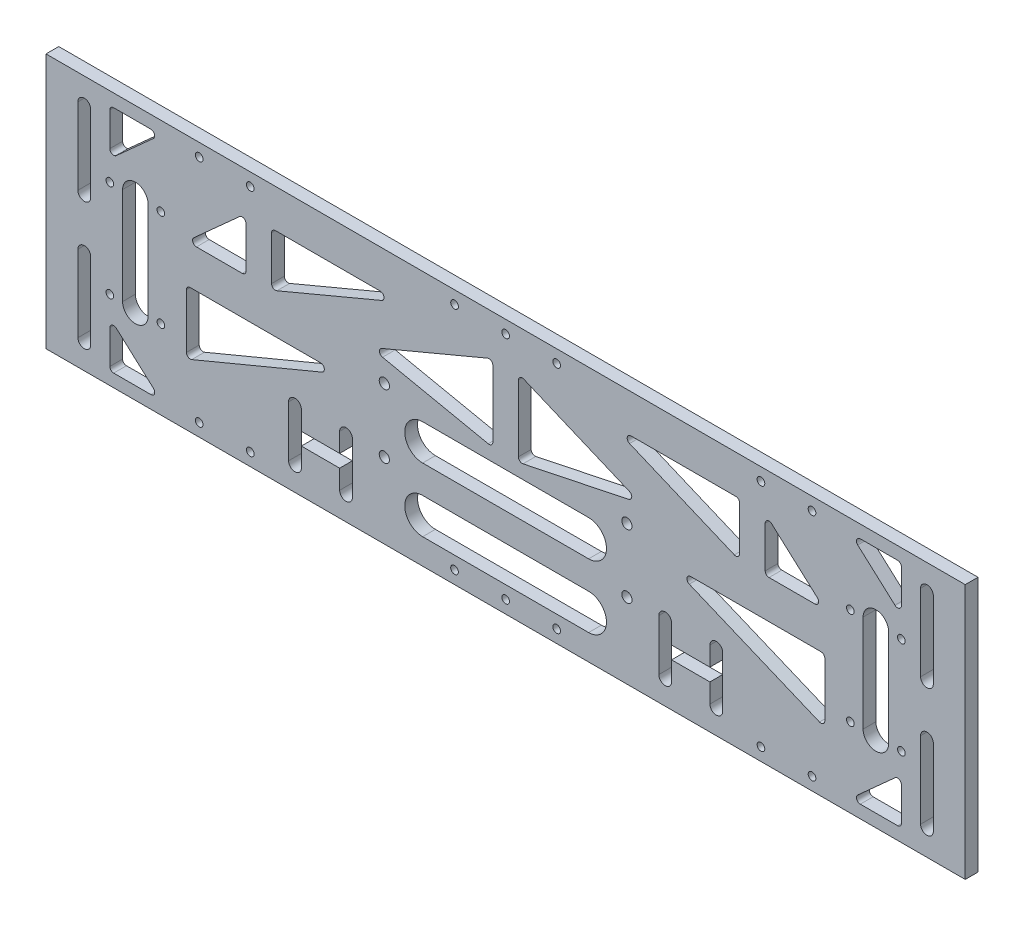
from build123d import *

# Parameters (mm, degrees)
SKETCH_1_W           = 320
SKETCH_1_H           = 121
EXTRUDE_1_DEPTH      = 5
SKETCH_2_W           = 5
SKETCH_2_H           = 30
CUT_EXTRUDE_1_DEPTH  = 343.14909031
SKETCH_3_R           = 1.5
CUT_EXTRUDE_2_DEPTH  = 343.14909031
SKETCH_4_R           = 1.5
CUT_EXTRUDE_3_DEPTH  = 343.14909031
SKETCH_6_R           = 2
CUT_EXTRUDE_5_DEPTH  = 343.14909031
SKETCH_5_W           = 250
SKETCH_5_H           = 30
CUT_EXTRUDE_4_DEPTH  = 343.14909031
SKETCH_7_W           = 260
SKETCH_7_H           = 30
EXTRUDE_2_DEPTH      = 5
SKETCH_8_W           = 320
SKETCH_8_H           = 21
CUT_EXTRUDE_6_DEPTH  = 5
SKETCH_9_W           = 15
SKETCH_9_H           = 100
EXTRUDE_3_DEPTH      = 5
CUT_EXTRUDE_7_DEPTH  = 5
CUT_EXTRUDE_8_DEPTH  = 5
SKETCH_15_R          = 1.5
CUT_EXTRUDE_9_DEPTH  = 357.217630108
SKETCH_16_W          = 5
SKETCH_16_H          = 19
CUT_EXTRUDE_10_DEPTH = 357.217630108
SKETCH_17_W          = 15
SKETCH_17_H          = 5
SKETCH_17_W_2        = 2.5
SKETCH_17_H_2        = 7.5
SKETCH_17_H_3        = 2.5
CUT_EXTRUDE_11_DEPTH = 357.217630108
SKETCH_18_W          = 5
SKETCH_18_H          = 100
EXTRUDE_4_DEPTH      = 5


with BuildPart() as part:
    # 草图1 → 凸台-拉伸1 (new body)
    with BuildSketch(Plane.XY):
        with Locations((160, 60.5)):
            Rectangle(SKETCH_1_W, SKETCH_1_H)
    extrude(amount=EXTRUDE_1_DEPTH)

    # 草图2 → 切除-拉伸1 (cut, through all)
    with BuildSketch(Plane.XY.offset(5)):
        with Locations((32.5, 15)):
            Rectangle(SKETCH_2_W, SKETCH_2_H)
        with Locations((287.5, 15)):
            Rectangle(SKETCH_2_W, SKETCH_2_H)
    extrude(amount=-CUT_EXTRUDE_1_DEPTH, mode=Mode.SUBTRACT)

    # 草图3 → 切除-拉伸2 (cut, through all)
    with BuildSketch(Plane.XY.offset(5)):
        with Locations((40, 116)):
            Circle(SKETCH_3_R)
        with Locations((60, 116)):
            Circle(SKETCH_3_R)
        with Locations((140, 116)):
            Circle(SKETCH_3_R)
        with Locations((160, 116)):
            Circle(SKETCH_3_R)
        with Locations(Location((260, 116, 0), (0, 0, 180))):
            Circle(SKETCH_3_R)
        with Locations(Location((280, 116, 0), (0, 0, 180))):
            Circle(SKETCH_3_R)
        with Locations(Location((180, 116, 0), (0, 0, 180))):
            Circle(SKETCH_3_R)
    extrude(amount=-CUT_EXTRUDE_2_DEPTH, mode=Mode.SUBTRACT)

    # 草图4 → 切除-拉伸3 (cut, through all)
    with BuildSketch(Plane.XY.offset(5)):
        with Locations((5, 90)):
            Circle(SKETCH_4_R)
        with Locations((25, 90)):
            Circle(SKETCH_4_R)
        with Locations((5, 10)):
            Circle(SKETCH_4_R)
        with Locations((25, 10)):
            Circle(SKETCH_4_R)
        with Locations(Location((295, 10, 0), (0, 0, 180))):
            Circle(SKETCH_4_R)
        with Locations(Location((315, 10, 0), (0, 0, 180))):
            Circle(SKETCH_4_R)
        with Locations(Location((295, 90, 0), (0, 0, 180))):
            Circle(SKETCH_4_R)
        with Locations(Location((315, 90, 0), (0, 0, 180))):
            Circle(SKETCH_4_R)
    extrude(amount=-CUT_EXTRUDE_3_DEPTH, mode=Mode.SUBTRACT)

    # 草图6 → 切除-拉伸5 (cut, through all)
    with BuildSketch(Plane.XY.offset(5)):
        with Locations((112.5, 75.5)):
            Circle(SKETCH_6_R)
        with Locations((207.5, 75.5)):
            Circle(SKETCH_6_R)
        with Locations((207.5, 50.5)):
            Circle(SKETCH_6_R)
        with Locations((112.5, 50.5)):
            Circle(SKETCH_6_R)
        with BuildLine():
            Line((127.5, 70), (192.5, 70))
            ThreePointArc((192.5, 70), (199.5, 63), (192.5, 56))
            Line((192.5, 56), (127.5, 56))
            ThreePointArc((127.5, 56), (120.5, 63), (127.5, 70))
        make_face()
    extrude(amount=-CUT_EXTRUDE_5_DEPTH, mode=Mode.SUBTRACT)

    # 草图5 → 切除-拉伸4 (cut, through all)
    with BuildSketch(Plane.XY.offset(5)):
        with BuildLine():
            Line((5, 101.368043607), (5, 114.5))
            ThreePointArc((5, 114.5), (5.439339828, 115.560660172), (6.5, 116))
            Line((6.5, 116), (21.091062659, 116))
            ThreePointArc((21.091062659, 116), (22.491493276, 115.037395651), (22.094509756, 113.385058781))
            Line((22.094509756, 113.385058781), (7.503447097, 100.253102388))
            ThreePointArc((7.503447097, 100.253102388), (5.889742123, 99.997793512), (5, 101.368043607))
        make_face()
        with BuildLine():
            Line((38.908937341, 85), (56.833333333, 85))
            ThreePointArc((56.833333333, 85), (57.893993505, 85.439339828), (58.333333333, 86.5))
            Line((58.333333333, 86.5), (58.333333333, 102.631956393))
            ThreePointArc((58.333333333, 102.631956393), (57.443591211, 104.002206488), (55.829886236, 103.746897612))
            Line((55.829886236, 103.746897612), (37.905490244, 87.614941219))
            ThreePointArc((37.905490244, 87.614941219), (37.508506724, 85.962604349), (38.908937341, 85))
        make_face()
        with BuildLine():
            Line((35, 68.5), (35, 47.25))
            ThreePointArc((35, 47.25), (35.667949706, 46.001924558), (37.076923077, 45.865384615))
            Line((37.076923077, 45.865384615), (88.076923077, 67.115384615))
            ThreePointArc((88.076923077, 67.115384615), (88.970871014, 68.794174203), (87.5, 70))
            Line((87.5, 70), (36.5, 70))
            ThreePointArc((36.5, 70), (35.439339828, 69.560660172), (35, 68.5))
        make_face()
        with Locations((160, 15)):
            Rectangle(SKETCH_5_W, SKETCH_5_H)
        with BuildLine():
            Line((68.333333333, 87.256929624), (68.333333333, 104.5))
            ThreePointArc((68.333333333, 104.5), (68.772673162, 105.560660172), (69.833333333, 106))
            Line((69.833333333, 106), (110.888262801, 106))
            ThreePointArc((110.888262801, 106), (112.358715068, 104.796260242), (111.469111528, 103.117026842))
            Line((111.469111528, 103.117026842), (70.41418206, 85.873956465))
            ThreePointArc((70.41418206, 85.873956465), (69.00305419, 86.007675228), (68.333333333, 87.256929624))
        make_face()
        with BuildLine():
            Line((111.788920254, 84.01540935), (153.193641955, 75.376872258))
            ThreePointArc((153.193641955, 75.376872258), (154.446166722, 75.68130869), (155, 76.845253935))
            Line((155, 76.845253935), (155, 102.873774141))
            ThreePointArc((155, 102.873774141), (154.330279143, 104.123028536), (152.919151273, 104.256747299))
            Line((152.919151273, 104.256747299), (111.514429572, 86.866764185))
            ThreePointArc((111.514429572, 86.866764185), (110.602180826, 85.340055375), (111.788920254, 84.01540935))
        make_face()
        with BuildLine():
            Line((167.080848727, 104.256747299), (208.485570428, 86.866764185))
            ThreePointArc((208.485570428, 86.866764185), (209.397819174, 85.340055375), (208.211079746, 84.01540935))
            Line((208.211079746, 84.01540935), (166.806358045, 75.376872258))
            ThreePointArc((166.806358045, 75.376872258), (165.553833278, 75.68130869), (165, 76.845253935))
            Line((165, 76.845253935), (165, 102.873774141))
            ThreePointArc((165, 102.873774141), (165.669720857, 104.123028536), (167.080848727, 104.256747299))
        make_face()
        with BuildLine():
            Line((208.530888472, 103.117026842), (249.58581794, 85.873956465))
            ThreePointArc((249.58581794, 85.873956465), (250.99694581, 86.007675228), (251.666666667, 87.256929624))
            Line((251.666666667, 87.256929624), (251.666666667, 104.5))
            ThreePointArc((251.666666667, 104.5), (251.227326838, 105.560660172), (250.166666667, 106))
            Line((250.166666667, 106), (209.111737199, 106))
            ThreePointArc((209.111737199, 106), (207.641284932, 104.796260242), (208.530888472, 103.117026842))
        make_face()
        with BuildLine():
            Line((232.5, 70), (283.5, 70))
            ThreePointArc((283.5, 70), (284.560660172, 69.560660172), (285, 68.5))
            Line((285, 68.5), (285, 47.25))
            ThreePointArc((285, 47.25), (284.332050294, 46.001924558), (282.923076923, 45.865384615))
            Line((282.923076923, 45.865384615), (231.923076923, 67.115384615))
            ThreePointArc((231.923076923, 67.115384615), (231.029128986, 68.794174203), (232.5, 70))
        make_face()
        with BuildLine():
            Line((264.170113764, 103.746897612), (282.094509756, 87.614941219))
            ThreePointArc((282.094509756, 87.614941219), (282.491493276, 85.962604349), (281.091062659, 85))
            Line((281.091062659, 85), (263.166666667, 85))
            ThreePointArc((263.166666667, 85), (262.106006495, 85.439339828), (261.666666667, 86.5))
            Line((261.666666667, 86.5), (261.666666667, 102.631956393))
            ThreePointArc((261.666666667, 102.631956393), (262.556408789, 104.002206488), (264.170113764, 103.746897612))
        make_face()
        with BuildLine():
            Line((297.905490244, 113.385058781), (312.496552903, 100.253102388))
            ThreePointArc((312.496552903, 100.253102388), (314.110257877, 99.997793512), (315, 101.368043607))
            Line((315, 101.368043607), (315, 114.5))
            ThreePointArc((315, 114.5), (314.560660172, 115.560660172), (313.5, 116))
            Line((313.5, 116), (298.908937341, 116))
            ThreePointArc((298.908937341, 116), (297.508506724, 115.037395651), (297.905490244, 113.385058781))
        make_face()
    extrude(amount=-CUT_EXTRUDE_4_DEPTH, mode=Mode.SUBTRACT)

    # 草图7 → 凸台-拉伸2 (add)
    with BuildSketch(Plane(origin=(0, 0, 0), x_dir=(-1, 0, 0), z_dir=(0, 0, -1))):
        with Locations((-160, 15)):
            Rectangle(SKETCH_7_W, SKETCH_7_H)
    extrude(amount=-EXTRUDE_2_DEPTH)

    # 草图8 → 切除-拉伸6 (cut)
    with BuildSketch(Plane(origin=(0, 0, 0), x_dir=(-1, 0, 0), z_dir=(0, 0, -1))):
        with Locations((-160, 10.5)):
            Rectangle(SKETCH_8_W, SKETCH_8_H)
    extrude(amount=-CUT_EXTRUDE_6_DEPTH, mode=Mode.SUBTRACT)

    # 草图9 → 凸台-拉伸3 (add)
    with BuildSketch(Plane(origin=(0, 0, 0), x_dir=(-1, 0, 0), z_dir=(0, 0, -1))):
        with Locations((-327.5, 71)):
            Rectangle(SKETCH_9_W, SKETCH_9_H)
        with Locations((7.5, 71)):
            Rectangle(SKETCH_9_W, SKETCH_9_H)
    extrude(amount=-EXTRUDE_3_DEPTH)

    # 草图10 → 切除-拉伸7 (cut)
    with BuildSketch(Plane(origin=(0, 0, 0), x_dir=(-1, 0, 0), z_dir=(0, 0, -1))):
        with BuildLine():
            Line((-325, 111), (-325, 81))
            Line((-325, 81), (-325, 78.5))
            ThreePointArc((-325, 78.5), (-323.232233047, 79.232233047), (-322.5, 81))
            Line((-322.5, 81), (-322.5, 111))
            ThreePointArc((-322.5, 111), (-323.232233047, 112.767766953), (-325, 113.5))
            Line((-325, 113.5), (-325, 111))
        make_face()
        with BuildLine():
            Line((-325, 78.5), (-325, 81))
            Line((-325, 81), (-325, 111))
            Line((-325, 111), (-325, 113.5))
            ThreePointArc((-325, 113.5), (-326.767766953, 112.767766953), (-327.5, 111))
            Line((-327.5, 111), (-327.5, 81))
            ThreePointArc((-327.5, 81), (-326.767766953, 79.232233047), (-325, 78.5))
        make_face()
        with BuildLine():
            ThreePointArc((-322.5, 61), (-323.232233047, 62.767766953), (-325, 63.5))
            Line((-325, 63.5), (-325, 61))
            Line((-325, 61), (-325, 31))
            Line((-325, 31), (-325, 28.5))
            ThreePointArc((-325, 28.5), (-323.232233047, 29.232233047), (-322.5, 31))
            Line((-322.5, 31), (-322.5, 61))
        make_face()
        with BuildLine():
            Line((-325, 61), (-325, 63.5))
            ThreePointArc((-325, 63.5), (-326.767766953, 62.767766953), (-327.5, 61))
            Line((-327.5, 61), (-327.5, 31))
            ThreePointArc((-327.5, 31), (-326.767766953, 29.232233047), (-325, 28.5))
            Line((-325, 28.5), (-325, 31))
            Line((-325, 31), (-325, 61))
        make_face()
        with BuildLine():
            Line((5, 113.5), (5, 78.5))
            ThreePointArc((5, 78.5), (6.767766953, 79.232233047), (7.5, 81))
            Line((7.5, 81), (7.5, 111))
            ThreePointArc((7.5, 111), (6.767766953, 112.767766953), (5, 113.5))
        make_face()
        with BuildLine():
            ThreePointArc((2.5, 81), (3.232233047, 79.232233047), (5, 78.5))
            Line((5, 78.5), (5, 113.5))
            ThreePointArc((5, 113.5), (3.232233047, 112.767766953), (2.5, 111))
            Line((2.5, 111), (2.5, 81))
        make_face()
        with BuildLine():
            ThreePointArc((7.5, 61), (6.767766953, 62.767766953), (5, 63.5))
            Line((5, 63.5), (5, 28.5))
            ThreePointArc((5, 28.5), (6.767766953, 29.232233047), (7.5, 31))
            Line((7.5, 31), (7.5, 61))
        make_face()
        with BuildLine():
            Line((5, 28.5), (5, 63.5))
            ThreePointArc((5, 63.5), (3.232233047, 62.767766953), (2.5, 61))
            Line((2.5, 61), (2.5, 31))
            ThreePointArc((2.5, 31), (3.232233047, 29.232233047), (5, 28.5))
        make_face()
    extrude(amount=-CUT_EXTRUDE_7_DEPTH, mode=Mode.SUBTRACT)

    # 草图13 → 切除-拉伸8 (cut)
    with BuildSketch(Plane(origin=(0, 0, 0), x_dir=(-1, 0, 0), z_dir=(0, 0, -1))):
        with BuildLine():
            Line((-192.5, 45), (-127.5, 45))
            ThreePointArc((-127.5, 45), (-120.5, 38), (-127.5, 31))
            Line((-127.5, 31), (-192.5, 31))
            ThreePointArc((-192.5, 31), (-199.5, 38), (-192.5, 45))
        make_face()
    extrude(amount=-CUT_EXTRUDE_8_DEPTH, mode=Mode.SUBTRACT)

    # 草图15 → 切除-拉伸9 (cut, through all)
    with BuildSketch(Plane(origin=(0, 0, 0), x_dir=(-1, 0, 0), z_dir=(0, 0, -1))):
        with Locations((-315, 52)):
            Circle(SKETCH_15_R)
        with BuildLine():
            ThreePointArc((-315, 40.631956393), (-314.110257877, 42.002206488), (-312.496552903, 41.746897612))
            Line((-312.496552903, 41.746897612), (-297.905490244, 28.614941219))
            ThreePointArc((-297.905490244, 28.614941219), (-297.508506724, 26.962604349), (-298.908937341, 26))
            Line((-298.908937341, 26), (-313.5, 26))
            ThreePointArc((-313.5, 26), (-314.560660172, 26.439339828), (-315, 27.5))
            Line((-315, 27.5), (-315, 40.631956393))
        make_face()
        with Locations((-295, 52)):
            Circle(SKETCH_15_R)
        with Locations((-280, 26)):
            Circle(SKETCH_15_R)
        with Locations((-260, 26)):
            Circle(SKETCH_15_R)
        with Locations((-180, 26)):
            Circle(SKETCH_15_R)
        with Locations((-160, 26)):
            Circle(SKETCH_15_R)
        with Locations((-140, 26)):
            Circle(SKETCH_15_R)
        with Locations((-60, 26)):
            Circle(SKETCH_15_R)
        with Locations((-40, 26)):
            Circle(SKETCH_15_R)
        with BuildLine():
            ThreePointArc((-21.091062659, 26), (-22.491493276, 26.962604349), (-22.094509756, 28.614941219))
            Line((-22.094509756, 28.614941219), (-7.503447097, 41.746897612))
            ThreePointArc((-7.503447097, 41.746897612), (-5.889742123, 42.002206488), (-5, 40.631956393))
            Line((-5, 40.631956393), (-5, 27.5))
            ThreePointArc((-5, 27.5), (-5.439339828, 26.439339828), (-6.5, 26))
            Line((-6.5, 26), (-21.091062659, 26))
        make_face()
        with Locations((-5, 52)):
            Circle(SKETCH_15_R)
        with Locations((-25, 52)):
            Circle(SKETCH_15_R)
    extrude(amount=-CUT_EXTRUDE_9_DEPTH, mode=Mode.SUBTRACT)

    # 草图16 → 切除-拉伸10 (cut, through all)
    with BuildSketch(Plane(origin=(0, 0, 0), x_dir=(-1, 0, 0), z_dir=(0, 0, -1))):
        with Locations((-302.5, 61.5)):
            Rectangle(SKETCH_16_W, SKETCH_16_H)
        with BuildLine():
            Line((-305, 52), (-310, 52))
            ThreePointArc((-310, 52), (-305, 47), (-300, 52))
            Line((-300, 52), (-305, 52))
        make_face()
        with Locations((-307.5, 61.5)):
            Rectangle(SKETCH_16_W, SKETCH_16_H)
        with Locations((-302.5, 80.5)):
            Rectangle(SKETCH_16_W, SKETCH_16_H)
        with Locations((-307.5, 80.5)):
            Rectangle(SKETCH_16_W, SKETCH_16_H)
        with BuildLine():
            ThreePointArc((-300, 90), (-305, 95), (-310, 90))
            Line((-310, 90), (-305, 90))
            Line((-305, 90), (-300, 90))
        make_face()
        with BuildLine():
            Line((-10, 71), (-20, 71))
            Line((-20, 71), (-20, 52))
            ThreePointArc((-20, 52), (-15, 47), (-10, 52))
            Line((-10, 52), (-10, 71))
        make_face()
        with BuildLine():
            Line((-20, 90), (-20, 71))
            Line((-20, 71), (-10, 71))
            Line((-10, 71), (-10, 90))
            ThreePointArc((-10, 90), (-15, 95), (-20, 90))
        make_face()
    extrude(amount=-CUT_EXTRUDE_10_DEPTH, mode=Mode.SUBTRACT)

    # 草图17 → 切除-拉伸11 (cut, through all)
    with BuildSketch(Plane(origin=(0, 0, 0), x_dir=(-1, 0, 0), z_dir=(0, 0, -1))):
        with BuildLine():
            Line((-77.5, 38), (-80, 38))
            Line((-80, 38), (-80, 30.5))
            ThreePointArc((-80, 30.5), (-77.5, 28), (-75, 30.5))
            Line((-75, 30.5), (-75, 40.5))
            ThreePointArc((-75, 40.5), (-75.732233047, 38.732233047), (-77.5, 38))
        make_face()
        with BuildLine():
            Line((-77.5, 43), (-80, 43))
            Line((-80, 43), (-80, 38))
            Line((-80, 38), (-77.5, 38))
            ThreePointArc((-77.5, 38), (-75.732233047, 38.732233047), (-75, 40.5))
            ThreePointArc((-75, 40.5), (-75.732233047, 42.267766953), (-77.5, 43))
        make_face()
        with BuildLine():
            Line((-80, 50.5), (-80, 43))
            Line((-80, 43), (-77.5, 43))
            ThreePointArc((-77.5, 43), (-75.732233047, 42.267766953), (-75, 40.5))
            Line((-75, 40.5), (-75, 50.5))
            ThreePointArc((-75, 50.5), (-77.5, 53), (-80, 50.5))
        make_face()
        with Locations((-87.5, 40.5)):
            Rectangle(SKETCH_17_W, SKETCH_17_H)
        with BuildLine():
            ThreePointArc((-97.5, 43), (-99.267766921, 42.267766985), (-100, 40.500000091))
            ThreePointArc((-100, 40.500000091), (-99.267766985, 38.732233079), (-97.5, 38))
            Line((-97.5, 38), (-95, 38))
            Line((-95, 38), (-95, 43))
            Line((-95, 43), (-97.5, 43))
        make_face()
        with BuildLine():
            ThreePointArc((-95, 50.5), (-97.5, 53), (-100, 50.5))
            Line((-100, 50.5), (-100, 40.500000091))
            ThreePointArc((-100, 40.500000091), (-99.267766921, 42.267766985), (-97.5, 43))
            Line((-97.5, 43), (-95, 43))
            Line((-95, 43), (-95, 50.5))
        make_face()
        with BuildLine():
            ThreePointArc((-97.5, 38), (-99.267766985, 38.732233079), (-100, 40.500000091))
            Line((-100, 40.500000091), (-100, 30.5))
            ThreePointArc((-100, 30.5), (-97.5, 28), (-95, 30.5))
            Line((-95, 30.5), (-95, 38))
            Line((-95, 38), (-97.5, 38))
        make_face()
        with Locations((-241.25, 46.75)):
            Rectangle(SKETCH_17_W_2, SKETCH_17_H_2)
        with BuildLine():
            Line((-242.5, 43), (-242.5, 50.5))
            Line((-242.5, 50.5), (-245, 50.5))
            Line((-245, 50.5), (-245, 40.5))
            ThreePointArc((-245, 40.5), (-244.267766953, 42.267766953), (-242.5, 43))
        make_face()
        with BuildLine():
            Line((-242.5, 50.5), (-240, 50.5))
            ThreePointArc((-240, 50.5), (-242.5, 53), (-245, 50.5))
            Line((-245, 50.5), (-242.5, 50.5))
        make_face()
        with Locations((-232.5, 41.75)):
            Rectangle(SKETCH_17_W, SKETCH_17_H_3)
        with Locations((-241.25, 41.75)):
            Rectangle(SKETCH_17_W_2, SKETCH_17_H_3)
        with BuildLine():
            Line((-242.5, 40.5), (-242.5, 43))
            ThreePointArc((-242.5, 43), (-244.267766953, 42.267766953), (-245, 40.5))
            Line((-245, 40.5), (-242.5, 40.5))
        make_face()
        with BuildLine():
            Line((-242.5, 40.5), (-245, 40.5))
            ThreePointArc((-245, 40.5), (-244.267766953, 38.732233047), (-242.5, 38))
            Line((-242.5, 38), (-242.5, 40.5))
        make_face()
        with Locations((-241.25, 39.25)):
            Rectangle(SKETCH_17_W_2, SKETCH_17_H_3)
        with Locations((-232.5, 39.25)):
            Rectangle(SKETCH_17_W, SKETCH_17_H_3)
        with Locations((-241.25, 34.25)):
            Rectangle(SKETCH_17_W_2, SKETCH_17_H_2)
        with BuildLine():
            ThreePointArc((-242.5, 38), (-244.267766953, 38.732233047), (-245, 40.5))
            Line((-245, 40.5), (-245, 30.5))
            Line((-245, 30.5), (-242.5, 30.5))
            Line((-242.5, 30.5), (-242.5, 38))
        make_face()
        with BuildLine():
            ThreePointArc((-245, 30.5), (-242.5, 28), (-240, 30.5))
            Line((-240, 30.5), (-242.5, 30.5))
            Line((-242.5, 30.5), (-245, 30.5))
        make_face()
        with BuildLine():
            ThreePointArc((-225, 30.5), (-222.5, 28), (-220, 30.5))
            Line((-220, 30.5), (-222.5, 30.5))
            Line((-222.5, 30.5), (-225, 30.5))
        make_face()
        with BuildLine():
            Line((-220, 30.5), (-220, 40.5))
            ThreePointArc((-220, 40.5), (-220.732233047, 38.732233047), (-222.5, 38))
            Line((-222.5, 38), (-222.5, 30.5))
            Line((-222.5, 30.5), (-220, 30.5))
        make_face()
        with Locations((-223.75, 34.25)):
            Rectangle(SKETCH_17_W_2, SKETCH_17_H_2)
        with Locations((-223.75, 39.25)):
            Rectangle(SKETCH_17_W_2, SKETCH_17_H_3)
        with BuildLine():
            ThreePointArc((-222.5, 38), (-220.732233047, 38.732233047), (-220, 40.5))
            Line((-220, 40.5), (-222.5, 40.5))
            Line((-222.5, 40.5), (-222.5, 38))
        make_face()
        with BuildLine():
            Line((-222.5, 40.5), (-220, 40.5))
            ThreePointArc((-220, 40.5), (-220.732233047, 42.267766953), (-222.5, 43))
            Line((-222.5, 43), (-222.5, 40.5))
        make_face()
        with Locations((-223.75, 41.75)):
            Rectangle(SKETCH_17_W_2, SKETCH_17_H_3)
        with Locations((-223.75, 46.75)):
            Rectangle(SKETCH_17_W_2, SKETCH_17_H_2)
        with BuildLine():
            Line((-220, 40.5), (-220, 50.5))
            Line((-220, 50.5), (-222.5, 50.5))
            Line((-222.5, 50.5), (-222.5, 43))
            ThreePointArc((-222.5, 43), (-220.732233047, 42.267766953), (-220, 40.5))
        make_face()
        with BuildLine():
            Line((-222.5, 50.5), (-220, 50.5))
            ThreePointArc((-220, 50.5), (-222.5, 53), (-225, 50.5))
            Line((-225, 50.5), (-222.5, 50.5))
        make_face()
    extrude(amount=-CUT_EXTRUDE_11_DEPTH, mode=Mode.SUBTRACT)

    # 草图18 → 凸台-拉伸4 (add)
    with BuildSketch(Plane(origin=(0, 0, 0), x_dir=(-1, 0, 0), z_dir=(0, 0, -1))):
        with Locations((-337.5, 71)):
            Rectangle(SKETCH_18_W, SKETCH_18_H)
        with Locations((17.5, 71)):
            Rectangle(SKETCH_18_W, SKETCH_18_H)
    extrude(amount=-EXTRUDE_4_DEPTH)


solid = part.part
